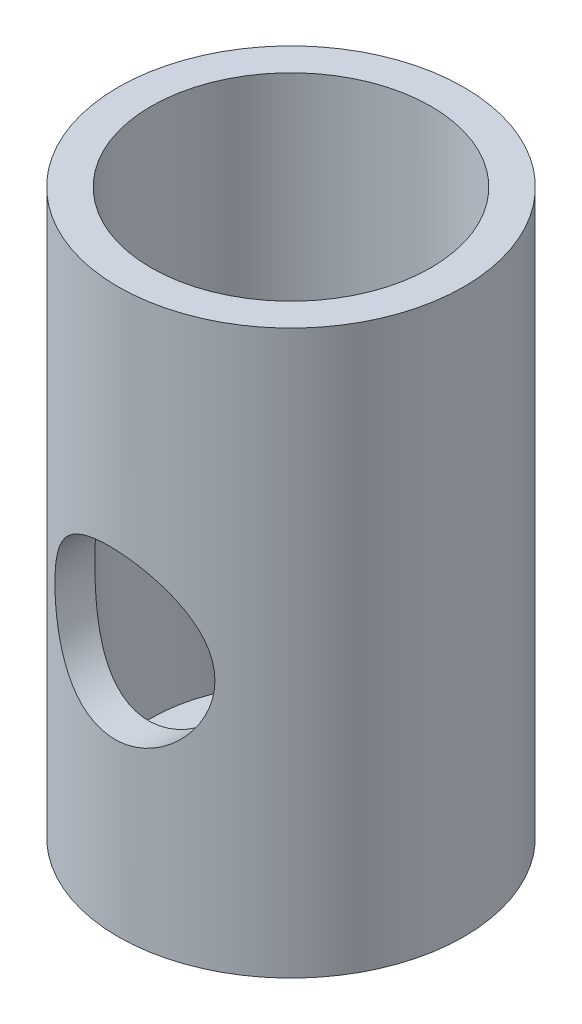
from build123d import *

# Parameters (mm, degrees)
TROU_TARAUD_0_801_D = 5


with BuildPart() as part:
    # Esquisse1 → Révolution1 (revolve)
    with BuildSketch(Plane.XY, mode=Mode.PRIVATE) as r_volution1_sk:
        Polygon((-4.25, 5.769230769), (-5.25, 5.769230769), (-5.25, -11.328656218), (0, -11.328656218), (0, -10.328656218), (-4.25, -10.328656218), align=None)
    revolve(r_volution1_sk.sketch.rotate(Axis((0, 8.346153846, 0), (0, -1, 0)), 270), axis=Axis((0, 8.346153846, 0), (0, -1, 0)))

    # Trou taraudé #0-801 (through all)
    with Locations(Plane(origin=(-0.143240146, -3.686819395, 5.248045566), x_dir=(0.999627726819, 0, 0.027283837244), z_dir=(-0.027283837244, 0, 0.999627726819))):
        with Locations((0, 0)):
            Hole(TROU_TARAUD_0_801_D / 2)


solid = part.part
